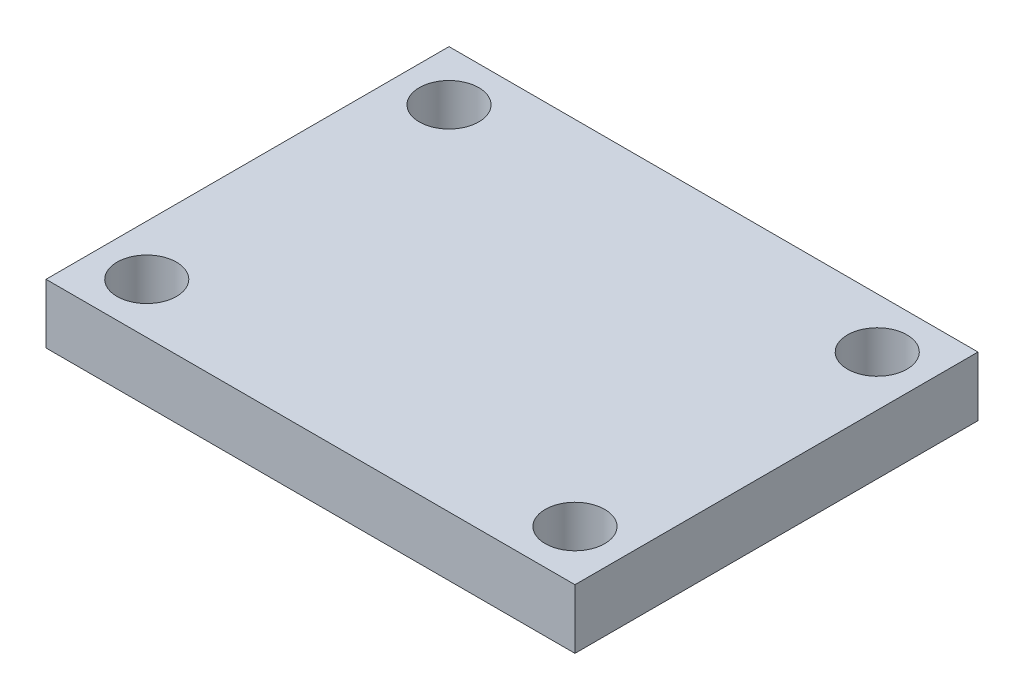
from build123d import *

# Parameters (mm, degrees)
CROQUIS1_W              = 26.67
CROQUIS1_H              = 20.32
SALIENTE_EXTRUIR1_DEPTH = 3
CROQUIS2_R              = 1.5
CORTAR_EXTRUIR1_DEPTH   = 34.662906886


with BuildPart() as part:
    # Croquis1 → Saliente-Extruir1 (new body)
    with BuildSketch(Plane(origin=(0, 0, 0), x_dir=(1, 0, 0), z_dir=(0, 1, 0))):
        with Locations((13.335, 10.16)):
            Rectangle(CROQUIS1_W, CROQUIS1_H)
    extrude(amount=SALIENTE_EXTRUIR1_DEPTH)

    # Croquis2 → Cortar-Extruir1 (cut, through all)
    with BuildSketch(Plane(origin=(0, 3, 0), x_dir=(1, 0, 0), z_dir=(0, 1, 0))):
        with Locations(Location((24.13, 2.54, 0), (0, 0, 270))):
            Circle(CROQUIS2_R)
        with Locations(Location((2.54, 2.54, 0), (0, 0, 270))):
            Circle(CROQUIS2_R)
        with Locations(Location((2.54, 17.78, 0), (0, 0, 270))):
            Circle(CROQUIS2_R)
        with Locations(Location((24.13, 17.78, 0), (0, 0, 270))):
            Circle(CROQUIS2_R)
    extrude(amount=-CORTAR_EXTRUIR1_DEPTH, mode=Mode.SUBTRACT)


solid = part.part
